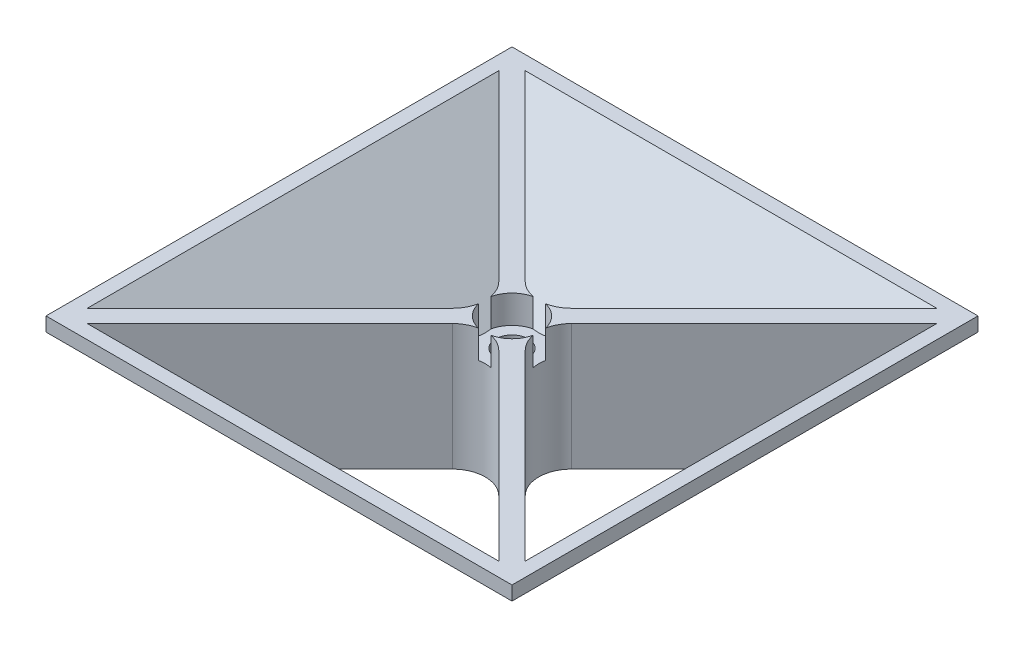
from build123d import *

# Parameters (mm, degrees)
SKETCH1_W           = 49.9
SKETCH1_H           = 49.9
BOSS_EXTRUDE1_DEPTH = 15
CHAMFER1_SIZE       = 13.5
CHAMFER2_SIZE       = 13.5
FILLET1_R           = 3.5
SKETCH2_R           = 3
SKETCH2_R_2         = 1.75
CUT_EXTRUDE1_DEPTH  = 3
SKETCH2_2_R         = 1.75
CUT_EXTRUDE2_DEPTH  = 39.34064423
CUT_EXTRUDE3_START  = -1.5
SKETCH3_R           = 1.75
CUT_EXTRUDE3_DEPTH  = 1.5


with BuildPart() as part:
    # Sketch1 → Boss-Extrude1 (new body)
    with BuildSketch(Plane(origin=(0, 0, 0), x_dir=(1, 0, 0), z_dir=(0, 1, 0))):
        Rectangle(SKETCH1_W, SKETCH1_H)
        Polygon((8.535786438, -9.95), (-8.535786438, -9.95), (0, -1.414213562), align=None, mode=Mode.SUBTRACT)
        Polygon((9.95, 8.535786438), (9.95, -8.535786438), (1.414213562, 0), align=None, mode=Mode.SUBTRACT)
        Polygon((-8.535786438, 9.95), (8.535786438, 9.95), (0, 1.414213562), align=None, mode=Mode.SUBTRACT)
        Polygon((-9.95, -8.535786438), (-9.95, 8.535786438), (-1.414213562, 0), align=None, mode=Mode.SUBTRACT)
    extrude(amount=BOSS_EXTRUDE1_DEPTH)

    # Chamfer1
    chamfer1_edges = [part.edges().sort_by_distance(p)[0] for p in [
        (-24.95, 0, 0),
        (0, 0, 24.95),
        (24.95, 0, 0),
        (0, 0, -24.95),
    ]]
    chamfer(chamfer1_edges, length=CHAMFER1_SIZE)

    # Chamfer2
    chamfer2_edges = [part.edges().sort_by_distance(p)[0] for p in [
        (0, 15, -9.95),
        (-9.95, 15, 0),
        (0, 15, 9.95),
        (9.95, 15, 0),
    ]]
    chamfer(chamfer2_edges, length=CHAMFER2_SIZE)

    # Fillet1
    fillet1_edges = [part.edges().sort_by_distance(p)[0] for p in [
        (0, 7.5, 1.414213562),
        (1.414213562, 7.5, 0),
        (0, 7.5, -1.414213562),
        (-1.414213562, 7.5, 0),
    ]]
    fillet(fillet1_edges, radius=FILLET1_R)

    # Sketch2 → Cut-Extrude1 (cut)
    with BuildSketch(Plane(origin=(0, 15, 0), x_dir=(1, 0, 0), z_dir=(0, 1, 0))):
        Circle(SKETCH2_R)
        Circle(SKETCH2_R_2, mode=Mode.SUBTRACT)
    extrude(amount=-CUT_EXTRUDE1_DEPTH, mode=Mode.SUBTRACT)

    # Sketch2<2> → Cut-Extrude2 (cut, through all)
    with BuildSketch(Plane(origin=(0, 15, 0), x_dir=(1, 0, 0), z_dir=(0, 1, 0))):
        Circle(SKETCH2_2_R)
    extrude(amount=-CUT_EXTRUDE2_DEPTH, mode=Mode.SUBTRACT)

    # Sketch3 → Cut-Extrude3 (cut)
    with BuildSketch(Plane.XZ.offset(CUT_EXTRUDE3_START)):
        with BuildLine():
            Line((-8.535786438, 9.95), (-9.95, 9.95))
            Line((-9.95, 9.95), (-9.95, 8.535786438))
            Line((-9.95, 8.535786438), (-3.889087297, 2.474873734))
            ThreePointArc((-3.889087297, 2.474873734), (-2.863961031, 0), (-3.889087297, -2.474873734))
            Line((-3.889087297, -2.474873734), (-9.95, -8.535786438))
            Line((-9.95, -8.535786438), (-9.95, -9.95))
            Line((-9.95, -9.95), (-8.535786438, -9.95))
            Line((-8.535786438, -9.95), (-2.474873734, -3.889087297))
            ThreePointArc((-2.474873734, -3.889087297), (0, -2.863961031), (2.474873734, -3.889087297))
            Line((2.474873734, -3.889087297), (8.535786438, -9.95))
            Line((8.535786438, -9.95), (9.95, -9.95))
            Line((9.95, -9.95), (9.95, -8.535786438))
            Line((9.95, -8.535786438), (3.889087297, -2.474873734))
            ThreePointArc((3.889087297, -2.474873734), (2.863961031, 0), (3.889087297, 2.474873734))
            Line((3.889087297, 2.474873734), (9.95, 8.535786438))
            Line((9.95, 8.535786438), (9.95, 9.95))
            Line((9.95, 9.95), (8.535786438, 9.95))
            Line((8.535786438, 9.95), (2.474873734, 3.889087297))
            ThreePointArc((2.474873734, 3.889087297), (0, 2.863961031), (-2.474873734, 3.889087297))
            Line((-2.474873734, 3.889087297), (-8.535786438, 9.95))
        make_face()
        Circle(SKETCH3_R, mode=Mode.SUBTRACT)
    extrude(amount=CUT_EXTRUDE3_DEPTH, mode=Mode.SUBTRACT)


solid = part.part
